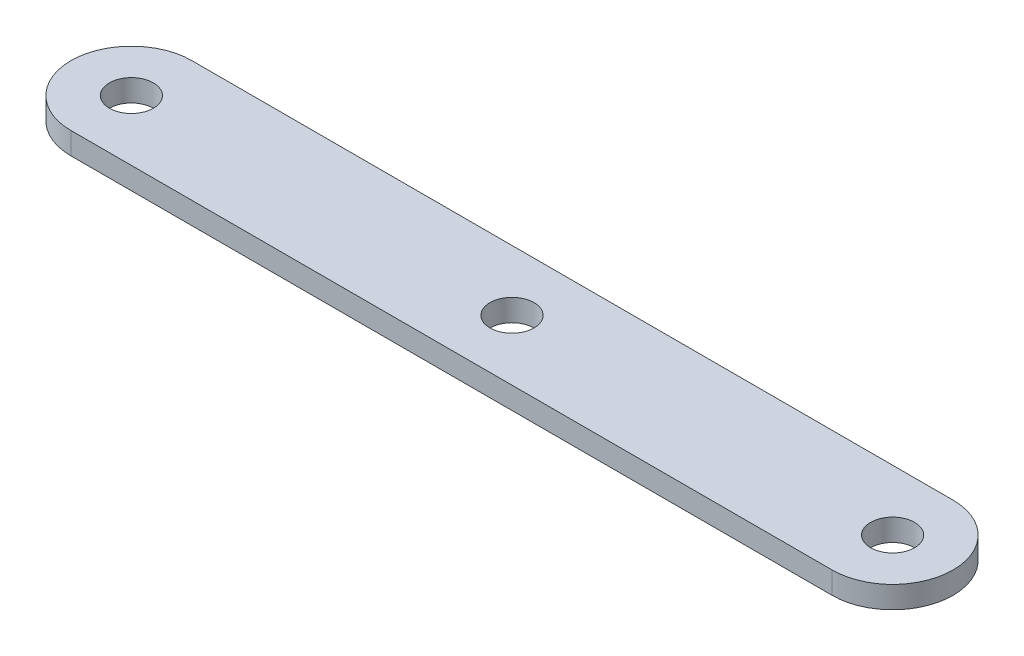
from build123d import *

# Parameters (mm, degrees)
SKETCH2_R           = 2
BOSS_EXTRUDE1_DEPTH = 2


with BuildPart() as part:
    # Sketch2 → Boss-Extrude1 (new body)
    with BuildSketch(Plane(origin=(0, 0, 0), x_dir=(1, 0, 0), z_dir=(0, 1, 0))):
        with BuildLine():
            Line((-34.61, 5.5), (34.61, 5.5))
            ThreePointArc((34.61, 5.5), (40.11, 0), (34.61, -5.5))
            Line((34.61, -5.5), (-34.61, -5.5))
            ThreePointArc((-34.61, -5.5), (-40.11, 0), (-34.61, 5.5))
        make_face()
        with Locations(Location((-34.61, 0, 0), (0, 0, 270))):
            Circle(SKETCH2_R, mode=Mode.SUBTRACT)
        with Locations(Location((34.61, 0, 0), (0, 0, 270))):
            Circle(SKETCH2_R, mode=Mode.SUBTRACT)
        with Locations(Location((0, 0, 0), (0, 0, 270))):
            Circle(SKETCH2_R, mode=Mode.SUBTRACT)
    extrude(amount=BOSS_EXTRUDE1_DEPTH)


solid = part.part
